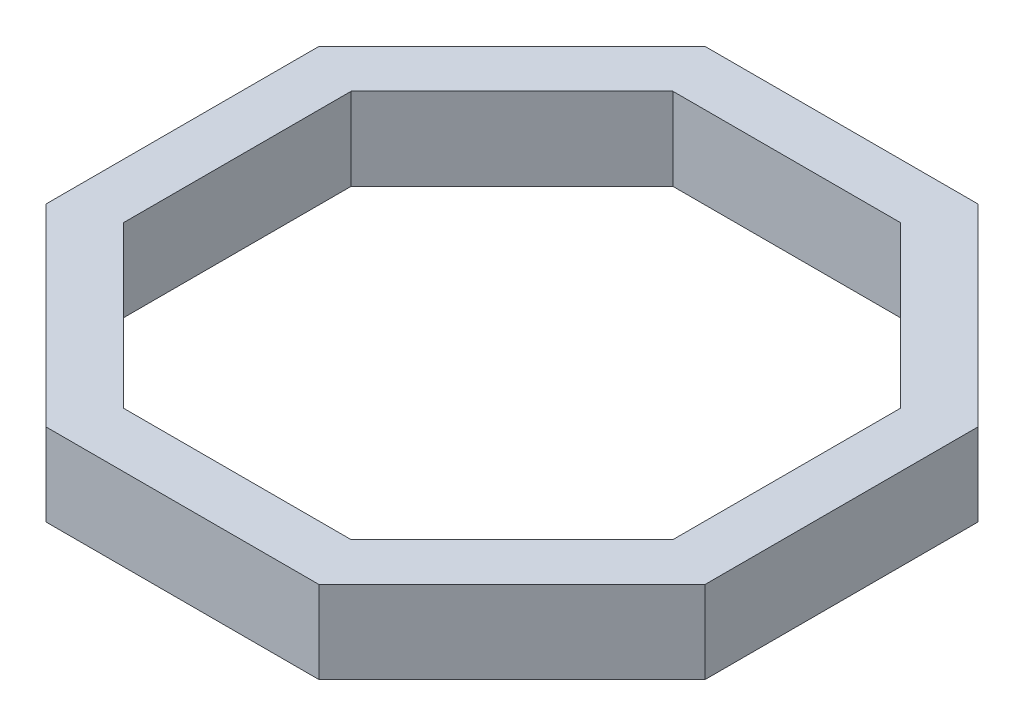
from build123d import *

# Parameters (mm, degrees)
RESSALTO_EXTRUS_O2_DEPTH = 30
CORTE_EXTRUS_O2_DEPTH    = 30


with BuildPart() as part:
    # Esboço1 → Ressalto-extrusão2 (new body)
    with BuildSketch(Plane(origin=(0, 0, 0), x_dir=(1, 0, 0), z_dir=(0, 1, 0))):
        Polygon((120, 49.705627485), (49.705627485, 120), (-49.705627485, 120), (-120, 49.705627485), (-120, -49.705627485), (-49.705627485, -120), (49.705627485, -120), (120, -49.705627485), align=None)
    extrude(amount=RESSALTO_EXTRUS_O2_DEPTH)

    # Esboço3 → Corte-extrusão2 (cut)
    with BuildSketch(Plane(origin=(0, 30, 0), x_dir=(1, 0, 0), z_dir=(0, 1, 0))):
        Polygon((100, 41.421356237), (41.421356237, 100), (-41.421356237, 100), (-100, 41.421356237), (-100, -41.421356237), (-41.421356237, -100), (41.421356237, -100), (100, -41.421356237), align=None)
    extrude(amount=-CORTE_EXTRUS_O2_DEPTH, mode=Mode.SUBTRACT)


solid = part.part
